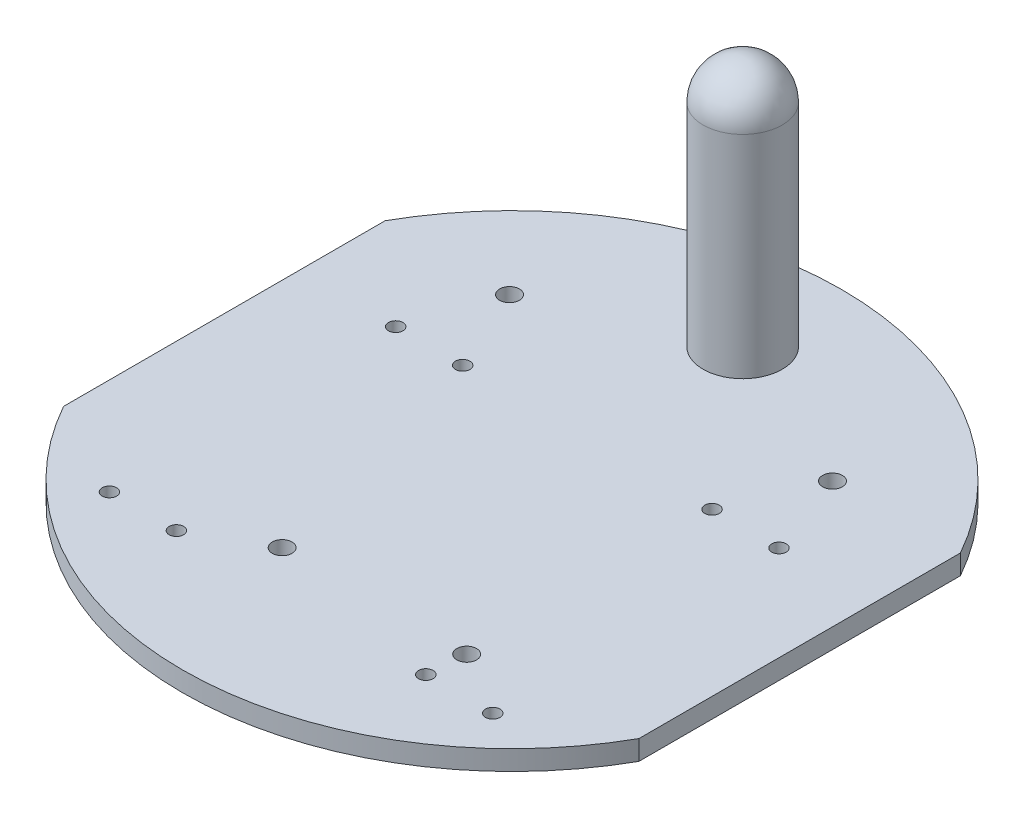
from build123d import *

# Parameters (mm, degrees)
SKETCH2_R           = 50
BOSS_EXTRUDE1_DEPTH = 3
SKETCH3_R           = 6
BOSS_EXTRUDE2_DEPTH = 38.1
FILLET1_R           = 6
CUT_EXTRUDE1_DEPTH  = 38.1
SKETCH7_R           = 1.1
CUT_EXTRUDE2_DEPTH  = 2.2
SKETCH8_R           = 1.5
CUT_EXTRUDE3_DEPTH  = 3


with BuildPart() as part:
    # Sketch2 → Boss-Extrude1 (new body)
    with BuildSketch(Plane(origin=(0, 0, 0), x_dir=(1, 0, 0), z_dir=(0, 1, 0))):
        with Locations(Location((0, 0, 0), (0, 0, 270))):
            Circle(SKETCH2_R)
    extrude(amount=BOSS_EXTRUDE1_DEPTH)

    # Sketch3 → Boss-Extrude2 (add)
    with BuildSketch(Plane(origin=(0, 3, 0), x_dir=(1, 0, 0), z_dir=(0, 1, 0))):
        with Locations(Location((0, 35, 0), (0, 0, 90))):
            Circle(SKETCH3_R)
    extrude(amount=BOSS_EXTRUDE2_DEPTH)

    # Fillet1
    fillet1_edges = [part.edges().sort_by_distance(p)[0] for p in [
        (0, 41.1, -29),
    ]]
    fillet(fillet1_edges, radius=FILLET1_R)

    # Sketch6 → Cut-Extrude1 (cut)
    with BuildSketch(Plane(origin=(0, 3, 0), x_dir=(1, 0, 0), z_dir=(0, 1, 0))):
        Polygon((-43.65, 24.386010334), (-43.65, -24.386010334), (-50, -24.386010334), (-50, 0), (-50, 24.386010334), align=None)
        Polygon((43.65, 24.386010334), (43.65, -24.386010334), (50, -24.386010334), (50, 0), (50, 24.386010334), align=None)
    extrude(amount=-CUT_EXTRUDE1_DEPTH, mode=Mode.SUBTRACT)

    # Sketch7 → Cut-Extrude2 (cut)
    with BuildSketch(Plane(origin=(0, 3, 0), x_dir=(1, 0, 0), z_dir=(0, 1, 0))):
        with Locations(Location((-28.93, 11.280989666, 0), (0, 0, 270))):
            Circle(SKETCH7_R)
        with Locations(Location((-18.77, 11.280989666, 0), (0, 0, 270))):
            Circle(SKETCH7_R)
        with Locations(Location((19.07, 11.280989666, 0), (0, 0, 270))):
            Circle(SKETCH7_R)
        with Locations(Location((29.23, 11.280989666, 0), (0, 0, 270))):
            Circle(SKETCH7_R)
        with Locations(Location((29.23, -32.153010334, 0), (0, 0, 270))):
            Circle(SKETCH7_R)
        with Locations(Location((19.07, -32.153010334, 0), (0, 0, 270))):
            Circle(SKETCH7_R)
        with Locations(Location((-18.77, -32.153010334, 0), (0, 0, 270))):
            Circle(SKETCH7_R)
        with Locations(Location((-28.93, -32.153010334, 0), (0, 0, 270))):
            Circle(SKETCH7_R)
    extrude(amount=-CUT_EXTRUDE2_DEPTH, mode=Mode.SUBTRACT)

    # Sketch8 → Cut-Extrude3 (cut)
    with BuildSketch(Plane(origin=(0, 0, 0), x_dir=(-1, 0, 0), z_dir=(0, -1, 0))):
        with Locations(Location((-19.5, -26.373989666, 0), (0, 0, 90))):
            Circle(SKETCH8_R)
        with Locations(Location((8.5, -26.373989666, 0), (0, 0, 90))):
            Circle(SKETCH8_R)
        with Locations(Location((-24.5, 24.126010334, 0), (0, 0, 90))):
            Circle(SKETCH8_R)
        with Locations(Location((24.5, 24.126010334, 0), (0, 0, 90))):
            Circle(SKETCH8_R)
    extrude(amount=-CUT_EXTRUDE3_DEPTH, mode=Mode.SUBTRACT)


solid = part.part
